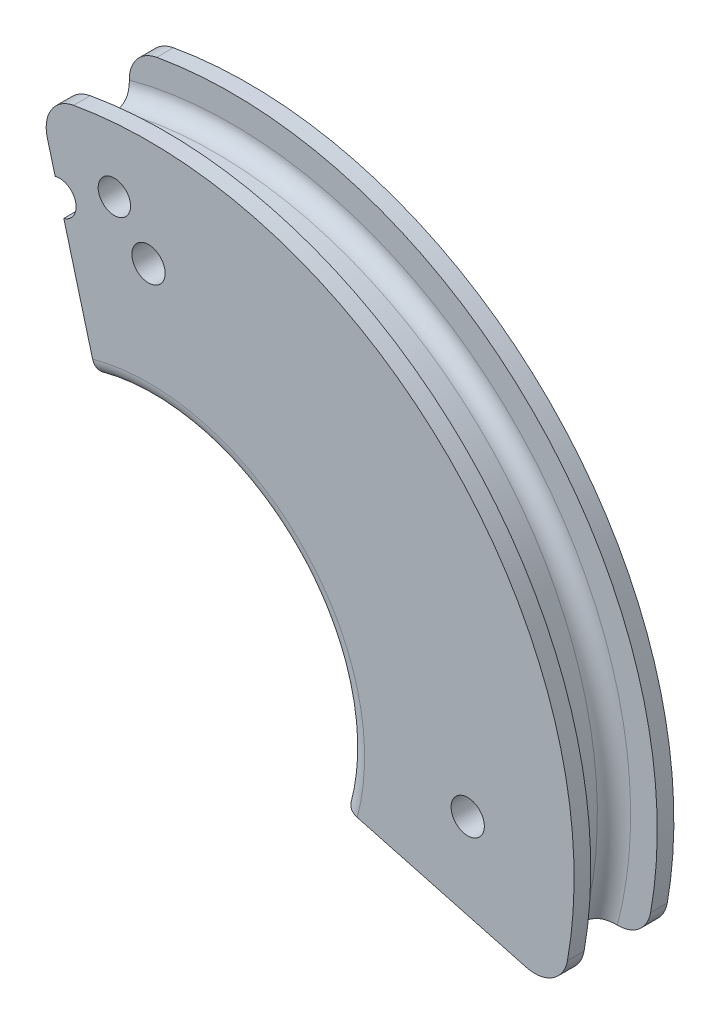
from build123d import *

# Parameters (mm, degrees)
SKETCH1_R               = 12
SKETCH1_R_2             = 0.5
SKETCH1_R_3             = 6
BOSS_EXTRUDE1_DEPTH     = 1.5
SKETCH6_W               = 0.8
SKETCH6_H               = 0.5
CUT_EXTRUDE1_DEPTH      = 19.163975336
CUT_EXTRUDE1_DEPTH_BACK = 19.163975336
CUT_EXTRUDE2_DEPTH      = 19.348841925
CUT_EXTRUDE2_DEPTH_BACK = 19.348841925
SKETCH5_R               = 0.5
SKETCH5_R_2             = 0.48729794
FILLET1_R               = 0.5
FILLET2_R               = 1


with BuildPart() as part:
    # Sketch1 → Boss-Extrude1 (new, symmetric)
    with BuildSketch(Plane.XY):
        Circle(SKETCH1_R)
        with Locations((9.6, 0)):
            Circle(SKETCH1_R_2, mode=Mode.SUBTRACT)
        Circle(SKETCH1_R_3, mode=Mode.SUBTRACT)
        with Locations((0, -9.6)):
            Circle(SKETCH1_R_2, mode=Mode.SUBTRACT)
        with Locations((-9.6, 0)):
            Circle(SKETCH1_R_2, mode=Mode.SUBTRACT)
        with Locations((0, 9.6)):
            Circle(SKETCH1_R_2, mode=Mode.SUBTRACT)
    extrude(amount=BOSS_EXTRUDE1_DEPTH, both=True)

    # Sketch2 → Cut-Revolve1 (revolve, cut)
    with BuildSketch(Plane(origin=(0, 0, 0), x_dir=(1, 0, 0), z_dir=(0, 1, 0)), mode=Mode.PRIVATE) as cut_revolve1_sk:
        with BuildLine():
            Line((-11.5, 0.5), (-11.5, -0.5))
            ThreePointArc((-11.5, -0.5), (-11.646446609, -0.853553391), (-12, -1))
            Line((-12, -1), (-12, 1))
            ThreePointArc((-12, 1), (-11.646446609, 0.853553391), (-11.5, 0.5))
        make_face()
    revolve(cut_revolve1_sk.sketch.rotate(Axis((0, 0, 0), (0, 0, -1)), 180), axis=Axis((0, 0, 0), (0, 0, -1)), mode=Mode.SUBTRACT)

    # Sketch6 → Revolve1 (revolve)
    with BuildSketch(Plane(origin=(0, 0, 0), x_dir=(1, 0, 0), z_dir=(0, 1, 0))):
        with Locations((12.4, 1.25)):
            Rectangle(SKETCH6_W, SKETCH6_H)
        with Locations((12.4, -1.25)):
            Rectangle(SKETCH6_W, SKETCH6_H)
    revolve(axis=Axis((0, 0, 0), (0, 0, -1)))

    # Sketch4 → Cut-Extrude1 (cut, two sides: drawn at the far end of the back side and taken through both)
    with BuildSketch(Plane.XY.offset(-CUT_EXTRUDE1_DEPTH_BACK)):
        Polygon((-3.743635752, 13.97143883), (0, 0), (14.900233226, -3.99250546), (14.900233226, -14.839385646), (-15.188066433, -14.839385646), (-15.188066433, 13.97143883), align=None)
    extrude(amount=CUT_EXTRUDE1_DEPTH + CUT_EXTRUDE1_DEPTH_BACK, mode=Mode.SUBTRACT)

    # Sketch5 → Cut-Extrude2 (cut, two sides: drawn at the far end of the back side and taken through both)
    with BuildSketch(Plane.XY.offset(1.5).offset(-CUT_EXTRUDE2_DEPTH_BACK)):
        with Locations((-2.67687174, 9.990221337)):
            Circle(SKETCH5_R)
        with Locations((-1.026834566, 10.829057404)):
            Circle(SKETCH5_R_2)
    extrude(amount=CUT_EXTRUDE2_DEPTH + CUT_EXTRUDE2_DEPTH_BACK, mode=Mode.SUBTRACT)

    # Fillet1
    fillet1_edges = [part.edges().sort_by_distance(p)[0] for p in [
        (4.242640687, 4.242640687, 1.5),
        (4.242640687, 4.242640687, -1.5),
    ]]
    fillet(fillet1_edges, radius=FILLET1_R)

    # Fillet2
    fillet2_edges = [part.edges().sort_by_distance(p)[0] for p in [
        (12.363850577, -3.312883777, -1.25),
        (12.363850577, -3.312883777, 1.25),
        (-3.312883777, 12.363850577, -1.25),
        (-3.312883777, 12.363850577, 1.25),
    ]]
    fillet(fillet2_edges, radius=FILLET2_R)


solid = part.part
